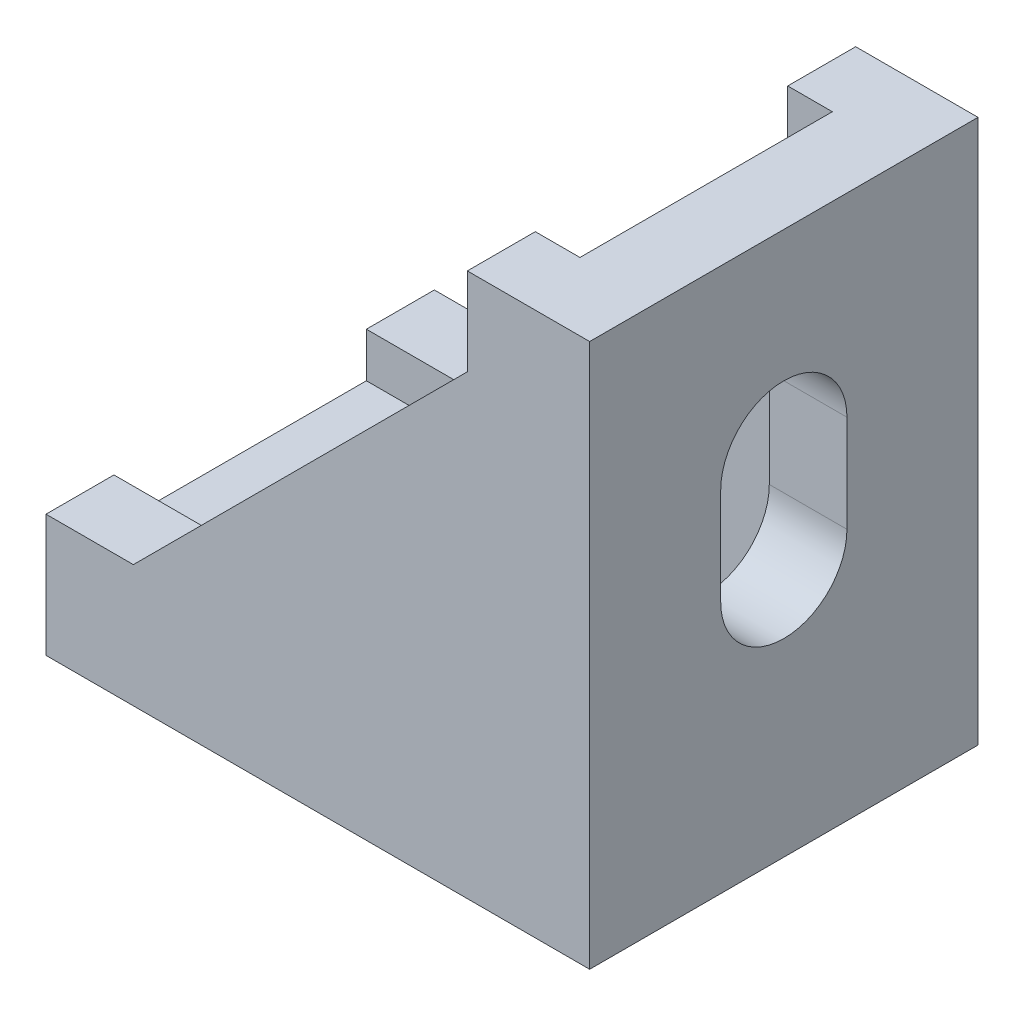
from build123d import *

# Parameters (mm, degrees)
EXTRUDE_1_DEPTH     = 20
EXTRUDE_2_DEPTH     = 3.5
CUT_EXTRUDE_2_DEPTH = 35.234485537
CUT_EXTRUDE_3_DEPTH = 35.234485537


with BuildPart() as part:
    # 草图1 → 凸台-拉伸1 (new body)
    with BuildSketch(Plane.XY):
        Polygon((14, -14), (-14, -14), (-14, -10), (10, -10), (10, 14), (14, 14), align=None)
    extrude(amount=EXTRUDE_1_DEPTH)

    # 草图3 → 凸台-拉伸2 (add)
    with BuildSketch(Plane(origin=(0, 0, 0), x_dir=(-1, 0, 0), z_dir=(0, 0, -1))):
        Polygon((-10, 14), (-7.7, 14), (-7.7, 9.5), (9.5, -7.7), (14, -7.7), (14, -10), (14, -14), (-14, -14), (-14, 14), align=None)
    extrude_2 = extrude(amount=-EXTRUDE_2_DEPTH)

    # 镜向2: 凸台-拉伸2 across plane
    add(extrude_2.mirror(Plane.XY.offset(10)))

    # 草图6 → 切除-拉伸2 (cut, through all)
    with BuildSketch(Plane.ZY.offset(-10)):
        with BuildLine():
            Line((13.25, 4), (13.25, -1))
            ThreePointArc((13.25, -1), (10, -4.25), (6.75, -1))
            Line((6.75, -1), (6.75, 4))
            ThreePointArc((6.75, 4), (10, 7.25), (13.25, 4))
        make_face()
    extrude(amount=-CUT_EXTRUDE_2_DEPTH, mode=Mode.SUBTRACT)

    # 草图8 → 切除-拉伸3 (cut, through all)
    with BuildSketch(Plane(origin=(0, -10, 0), x_dir=(1, 0, 0), z_dir=(0, 1, 0))):
        with BuildLine():
            Line((-4, -6.75), (1, -6.75))
            ThreePointArc((1, -6.75), (4.25, -10), (1, -13.25))
            Line((1, -13.25), (-4, -13.25))
            ThreePointArc((-4, -13.25), (-7.25, -10), (-4, -6.75))
        make_face()
    extrude(amount=-CUT_EXTRUDE_3_DEPTH, mode=Mode.SUBTRACT)


solid = part.part
